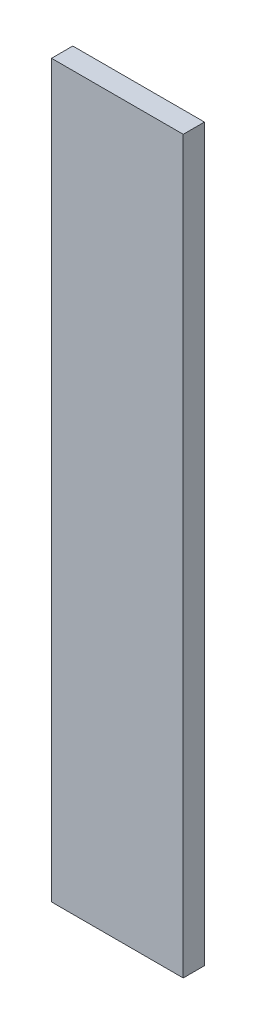
from build123d import *

# Parameters (mm, degrees)
SKETCH1_W             = 860
SKETCH1_H             = 155
BOSS_EXTRUDE1_DEPTH   = 25
BODY_MOVE_COPY2_ANGLE = 90


with BuildPart() as part:
    # Sketch1 → Boss-Extrude1 (new body)
    with BuildSketch(Plane.XY):
        with Locations((430, 77.5)):
            Rectangle(SKETCH1_W, SKETCH1_H)
    extrude(amount=BOSS_EXTRUDE1_DEPTH)


with BuildPart() as part_1:
    # Body-Move/Copy2: moved
    add(part.part.rotate(Axis((0, 0, 0), (0, 0, 1)), BODY_MOVE_COPY2_ANGLE))


with BuildPart() as part_2:
    # Body-Move/Copy3: moved
    add(part_1.part.moved(Location((155, 0, 0))))


solid = part_2.part
